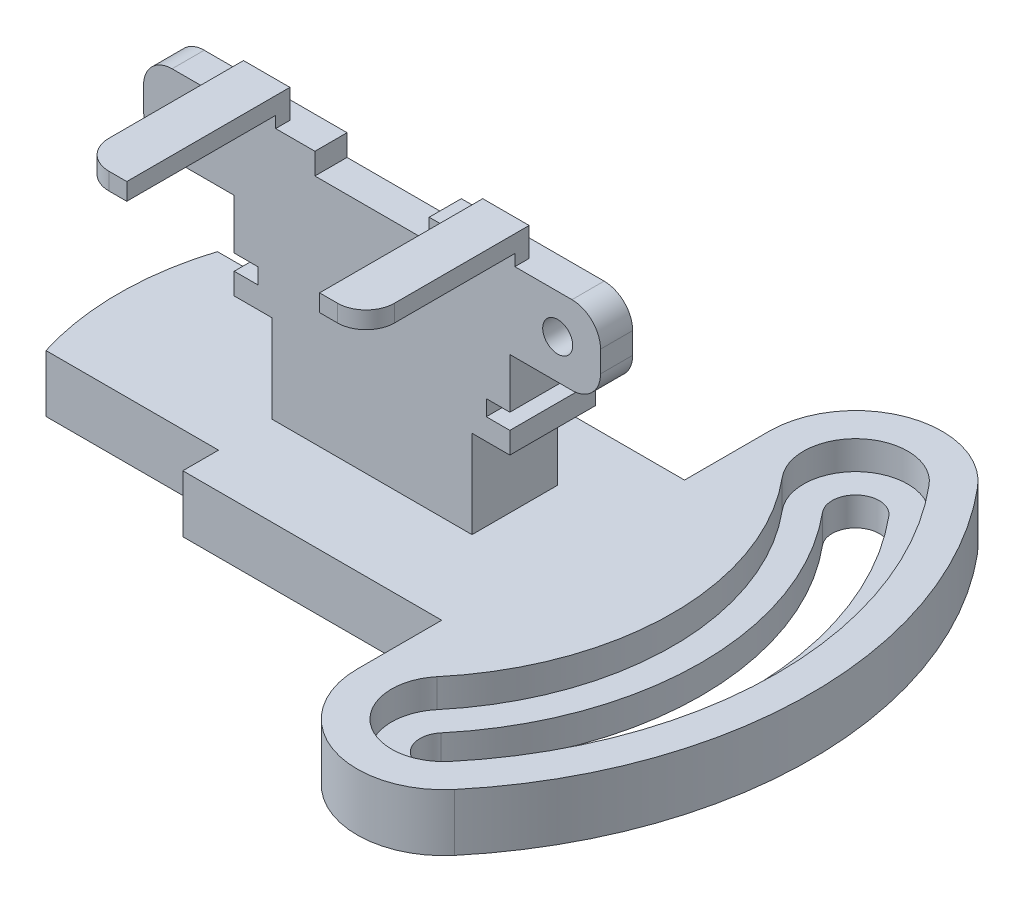
from build123d import *

# Parameters (mm, degrees)
BOSS_EXTRUDE1_DEPTH    = 1.125
M1_8_CLEARANCE_HOLE1_D = 2.1
BOSS_EXTRUDE3_DEPTH    = 4
SKETCH10_R             = 4
BOSS_EXTRUDE4_DEPTH    = 2.8
CUT_EXTRUDE1_DEPTH     = 2
BOSS_EXTRUDE9_DEPTH    = 6
SKETCH21_W             = 3.25
SKETCH21_H             = 1
BOSS_EXTRUDE10_DEPTH   = 2
BOSS_EXTRUDE13_DEPTH   = 1.2
SKETCH25_W             = 14
SKETCH25_H             = 3.75
BOSS_EXTRUDE12_DEPTH   = 10


with BuildPart() as part:
    # Sketch1 → Boss-Extrude1 (new, symmetric)
    with BuildSketch(Plane.XY):
        with BuildLine():
            Line((-7, -8.85), (-7, -15))
            Line((-7, -15), (7, -15))
            Line((7, -15), (7, -8.85))
            Line((7, -8.85), (9.65, -8.85))
            Line((9.65, -8.85), (9.65, -7.35))
            Line((9.65, -7.35), (8, -7.35))
            Line((8, -7.35), (8, -6.25))
            Line((8, -6.25), (9.65, -6.25))
            Line((9.65, -6.25), (9.65, -2.75))
            Line((9.65, -2.75), (14, -2.75))
            ThreePointArc((14, -2.75), (15.414213562, -2.164213562), (16, -0.75))
            Line((16, -0.75), (16, 0.75))
            ThreePointArc((16, 0.75), (15.414213562, 2.164213562), (14, 2.75))
            Line((14, 2.75), (4, 2.75))
            Line((4, 2.75), (4, 1.25))
            Line((4, 1.25), (-4, 1.25))
            Line((-4, 1.25), (-4, 2.75))
            Line((-4, 2.75), (-14, 2.75))
            ThreePointArc((-14, 2.75), (-15.414213562, 2.164213562), (-16, 0.75))
            Line((-16, 0.75), (-16, -0.75))
            ThreePointArc((-16, -0.75), (-15.414213562, -2.164213562), (-14, -2.75))
            Line((-14, -2.75), (-9.65, -2.75))
            Line((-9.65, -2.75), (-9.65, -6.25))
            Line((-9.65, -6.25), (-8, -6.25))
            Line((-8, -6.25), (-8, -7.35))
            Line((-8, -7.35), (-9.65, -7.35))
            Line((-9.65, -7.35), (-9.65, -8.85))
            Line((-9.65, -8.85), (-7, -8.85))
        make_face()
    extrude(amount=BOSS_EXTRUDE1_DEPTH, both=True)

    # M1.8 Clearance Hole1 (through all)
    with Locations(Plane.XY.offset(1.125)):
        with Locations((-13, 0), (13, 0)):
            Hole(M1_8_CLEARANCE_HOLE1_D / 2)

    # Sketch8 → Boss-Extrude3 (add)
    with BuildSketch(Plane.XZ.offset(15)):
        with BuildLine():
            Line((-7, -7.125), (-7, -9.625))
            Line((-7, -9.625), (11.129010548, -9.625))
            Line((11.129010548, -9.625), (11.129010548, -15.548780253))
            ThreePointArc((11.129010548, -15.548780253), (15.116751021, -21.24386386), (21.832266629, -19.444446876))
            ThreePointArc((21.832266629, -19.444446876), (28.5, -1.125), (21.832266629, 17.194446876))
            ThreePointArc((21.832266629, 17.194446876), (15.116751021, 18.99386386), (11.129010548, 13.298780253))
            Line((11.129010548, 13.298780253), (11.129010548, 7.375))
            Line((11.129010548, 7.375), (-7, 7.375))
            Line((-7, 7.375), (-7, 4.875))
            Line((-7, 4.875), (-19.078784028, 4.875))
            ThreePointArc((-19.078784028, 4.875), (-20, -1.125), (-19.078784028, -7.125))
            Line((-19.078784028, -7.125), (-7, -7.125))
        make_face()
        with BuildLine():
            ThreePointArc((15.925618604, -14.488180697), (20.789418613, -1.125), (15.925618604, 12.238180697))
            ThreePointArc((15.925618604, 12.238180697), (16.128992379, 14.562753584), (18.453565266, 14.359379809))
            ThreePointArc((18.453565266, 14.359379809), (24.089418613, -1.125000171), (18.453565046, -16.609380071))
            ThreePointArc((18.453565046, -16.609380071), (16.128992248, -16.812753474), (15.925618604, -14.488180697))
        make_face(mode=Mode.SUBTRACT)
    extrude(amount=BOSS_EXTRUDE3_DEPTH)

    # Sketch10 → Boss-Extrude4 (add)
    with BuildSketch(Plane(origin=(0, -19, 0), x_dir=(-1, 0, 0), z_dir=(0, -1, 0))):
        with Locations(Location((0, 1.125, 0), (0, 0, 90))):
            Circle(SKETCH10_R)
    extrude(amount=BOSS_EXTRUDE4_DEPTH)

    # Sketch11 → Cut-Extrude1 (cut)
    with BuildSketch(Plane(origin=(0, -15, 0), x_dir=(1, 0, 0), z_dir=(0, 1, 0))):
        with BuildLine():
            ThreePointArc((14.393529718, -10.952605478), (18.789418613, 1.125), (14.393529718, 13.202605478))
            ThreePointArc((14.393529718, 13.202605478), (14.84341687, 18.344842227), (19.985653666, 17.894955608))
            ThreePointArc((19.985653666, 17.894955608), (26.089418613, 1.125000379), (19.985654153, -15.644955028))
            ThreePointArc((19.985654153, -15.644955028), (14.84341716, -16.09484247), (14.393529718, -10.952605478))
        make_face()
        with BuildLine():
            ThreePointArc((18.453565046, 16.609380071), (16.128992248, 16.812753474), (15.925618604, 14.488180697))
            ThreePointArc((15.925618604, 14.488180697), (20.789418613, 1.125), (15.925618604, -12.238180697))
            ThreePointArc((15.925618604, -12.238180697), (16.128992379, -14.562753584), (18.453565266, -14.359379809))
            ThreePointArc((18.453565266, -14.359379809), (24.089418613, 1.125000171), (18.453565046, 16.609380071))
        make_face(mode=Mode.SUBTRACT)
    extrude(amount=-CUT_EXTRUDE1_DEPTH, mode=Mode.SUBTRACT)

    # Sketch19 → Boss-Extrude9 (add)
    with BuildSketch(Plane.XY.offset(1.125)):
        Polygon((-9.65, -5), (-9.65, -6.25), (-8, -6.25), (-8, -7.35), (-9.65, -7.35), (-9.65, -8.85), (-6.6, -8.85), (-6.6, -5), align=None)
    boss_extrude9 = extrude(amount=-BOSS_EXTRUDE9_DEPTH)

    # Mirror1: Boss-Extrude9 across plane
    add(boss_extrude9.mirror(Plane(origin=(0, 0, 0), x_dir=(0, 0, 1), z_dir=(1, 0, 0))))

    # Sketch21 → Boss-Extrude10 (add)
    with BuildSketch(Plane(origin=(0, 2.75, 0), x_dir=(1, 0, 0), z_dir=(0, 1, 0))):
        with Locations((-8.375, -0.625)):
            Rectangle(SKETCH21_W, SKETCH21_H)
        with Locations((8.375, -0.625)):
            Rectangle(SKETCH21_W, SKETCH21_H)
    extrude(amount=BOSS_EXTRUDE10_DEPTH)

    # Sketch26 → Boss-Extrude13 (add)
    with BuildSketch(Plane(origin=(0, 4.75, 0), x_dir=(1, 0, 0), z_dir=(0, 1, 0))):
        with BuildLine():
            Line((-10, -0.125), (-6.75, -0.125))
            Line((-6.75, -0.125), (-6.75, -11.547583435))
            Line((-6.75, -11.547583435), (-8, -11.547583435))
            ThreePointArc((-8, -11.547583435), (-9.414213562, -10.961796997), (-10, -9.547583435))
            Line((-10, -9.547583435), (-10, -0.125))
        make_face()
        with BuildLine():
            Line((6.75, -0.125), (6.75, -11.547583435))
            Line((6.75, -11.547583435), (8, -11.547583435))
            ThreePointArc((8, -11.547583435), (9.414213562, -10.961796997), (10, -9.547583435))
            Line((10, -9.547583435), (10, -0.125))
            Line((10, -0.125), (6.75, -0.125))
        make_face()
    extrude(amount=-BOSS_EXTRUDE13_DEPTH)

    # Sketch25 → Boss-Extrude12 (add)
    with BuildSketch(Plane(origin=(0, -5, 0), x_dir=(1, 0, 0), z_dir=(0, 1, 0))):
        with Locations((0, 3)):
            Rectangle(SKETCH25_W, SKETCH25_H)
    extrude(amount=-BOSS_EXTRUDE12_DEPTH)


solid = part.part
